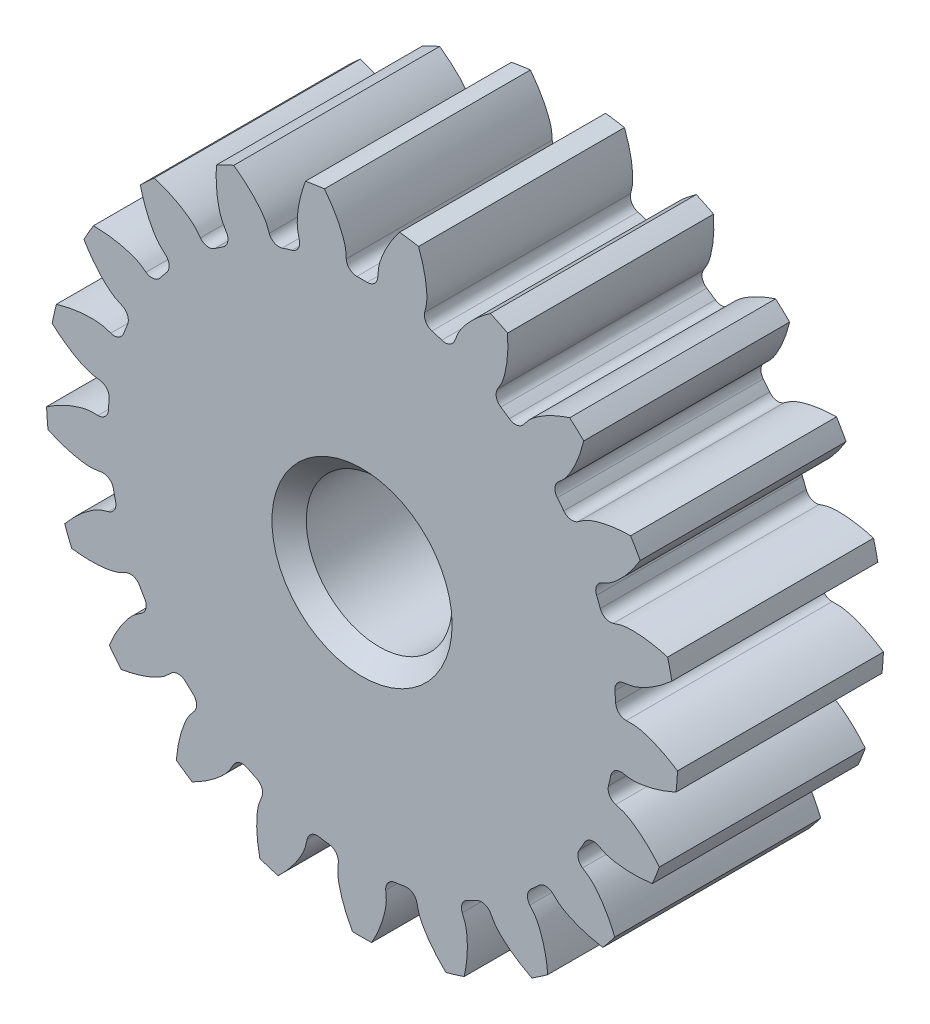
from build123d import *

# Parameters (mm, degrees)
SKETCH1_R           = 9.2
LASHENA_DEPTH       = 6
CUT_EXTRUDEA_DEPTH  = 6
WWW_KYTOOL_CN_COUNT = 21
SKETCH3_R           = 2.125
CUT_EXTRUDE2_DEPTH  = 15.321774278
CHAMFER1_SIZE       = 0.5


with BuildPart() as part:
    # Sketch1 → LaShenA (new body)
    with BuildSketch(Plane.XY):
        Circle(SKETCH1_R)
    extrude(amount=LASHENA_DEPTH)

    # SketchA → Cut-ExtrudeA (cut)
    with BuildSketch(Plane.XY.offset(6)):
        with BuildLine():
            ThreePointArc((0.150151275, 7.398476505), (0, 7.4), (-0.150151275, 7.398476505))
            ThreePointArc((-0.150151275, 7.398476505), (-0.362464006, 7.478984947), (-0.459770099, 7.684143007))
            add(Edge.make_bspline(
                [(-0.459770099, 7.684143007), (-0.463710347, 7.749584187), (-0.466358647, 7.838391604), (-0.480749143, 7.937246168), (-0.49064274, 7.983176084), (-0.499380614, 8.019547534), (-0.510625332, 8.061218439), (-0.524622128, 8.108088993), (-0.541673864, 8.160032671), (-0.562058501, 8.216916082), (-0.586055285, 8.278592756), (-0.613935885, 8.34490535), (-0.645966621, 8.415685217), (-0.682407247, 8.490752804), (-0.723510802, 8.569917825), (-0.769523146, 8.65297951), (-0.820682606, 8.739726855), (-0.877219594, 8.829938884), (-0.939356246, 8.923384924), (-1.007306065, 9.019824899), (-1.0812736, 9.119009621), (-1.161454005, 9.220681117), (-1.279349009, 9.362150803), (-1.374036255, 9.466673471), (-1.440241313, 9.536059069)],
                knots=[0.123319169, 0.123319169, 0.123319169, 0.123319169, 0.203409424, 0.232855636, 0.245818138, 0.261137458, 0.278813596, 0.298846552, 0.321236326, 0.345982919, 0.37308633, 0.402546559, 0.434363606, 0.468537472, 0.505068156, 0.543955658, 0.585199978, 0.628801117, 0.674759074, 0.723073849, 0.773745443, 0.826773855, 0.882159085, 1, 1, 1, 1], degree=3))
            ThreePointArc((-1.440241313, 9.536059069), (0, 9.644206427), (1.440241313, 9.536059069))
            add(Edge.make_bspline(
                [(0.459770099, 7.684143007), (0.463710347, 7.749584187), (0.466358647, 7.838391604), (0.480749143, 7.937246168), (0.49064274, 7.983176084), (0.499380614, 8.019547534), (0.510625332, 8.061218439), (0.524622128, 8.108088993), (0.541673864, 8.160032671), (0.562058501, 8.216916082), (0.586055285, 8.278592756), (0.613935885, 8.34490535), (0.645966621, 8.415685217), (0.682407247, 8.490752804), (0.723510802, 8.569917825), (0.769523146, 8.65297951), (0.820682606, 8.739726855), (0.877219594, 8.829938884), (0.939356246, 8.923384924), (1.007306065, 9.019824899), (1.0812736, 9.119009621), (1.161454005, 9.220681117), (1.279349009, 9.362150803), (1.374036255, 9.466673471), (1.440241313, 9.536059069)],
                knots=[0.123319169, 0.123319169, 0.123319169, 0.123319169, 0.203409424, 0.232855636, 0.245818138, 0.261137458, 0.278813596, 0.298846552, 0.321236326, 0.345982919, 0.37308633, 0.402546559, 0.434363606, 0.468537472, 0.505068156, 0.543955658, 0.585199978, 0.628801117, 0.674759074, 0.723073849, 0.773745443, 0.826773855, 0.882159085, 1, 1, 1, 1], degree=3))
            ThreePointArc((0.459770099, 7.684143007), (0.362464006, 7.478984947), (0.150151275, 7.398476505))
        make_face()
    cut_extrudea = extrude(amount=-CUT_EXTRUDEA_DEPTH, mode=Mode.SUBTRACT)

    # www.KYTool.cn: Cut-ExtrudeA ×21 about axis
    www_kytool_cn_axis = Axis((0, 0, -88.99), (0, 0, 1))
    for i in range(1, WWW_KYTOOL_CN_COUNT):
        add(cut_extrudea.rotate(www_kytool_cn_axis, i * 360 / WWW_KYTOOL_CN_COUNT), mode=Mode.SUBTRACT)

    # Sketch3 → Cut-Extrude2 (cut, through all)
    with BuildSketch(Plane.XY.offset(6)):
        Circle(SKETCH3_R)
    extrude(amount=-CUT_EXTRUDE2_DEPTH, mode=Mode.SUBTRACT)

    # Chamfer1
    chamfer1_edges = [part.edges().sort_by_distance(p)[0] for p in [
        (-2.125, 0, 0),
        (-2.125, 0, 6),
    ]]
    chamfer(chamfer1_edges, length=CHAMFER1_SIZE)


solid = part.part
